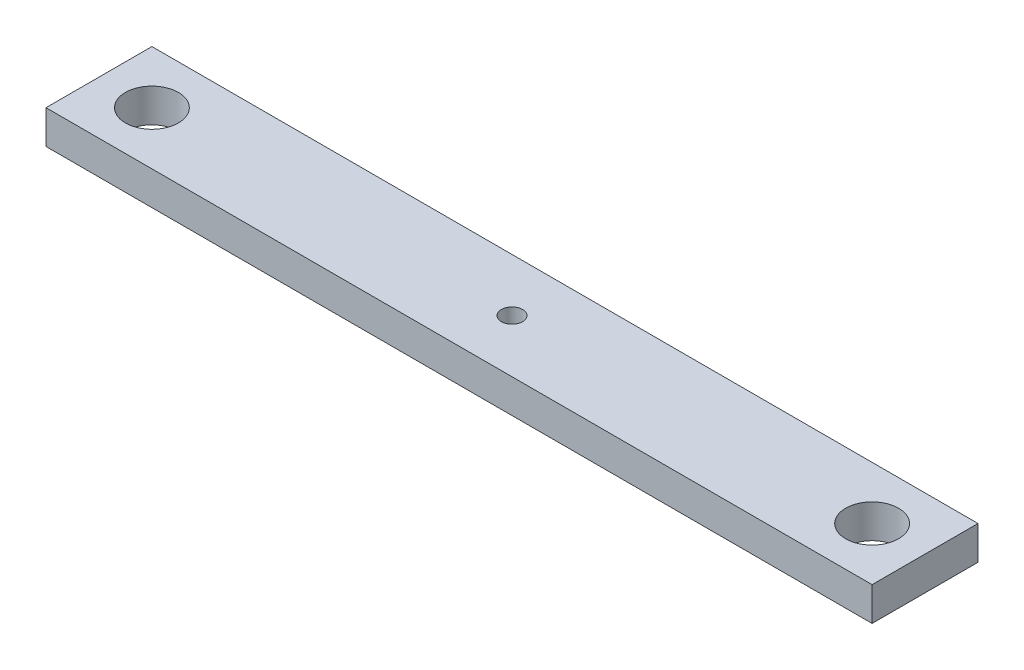
from build123d import *

# Parameters (mm, degrees)
SKETCH2_W           = 78
SKETCH2_H           = 10
BOSS_EXTRUDE1_DEPTH = 3.175
SKETCH3_R           = 2.5
CUT_EXTRUDE1_DEPTH  = 3.175
CUT_EXTRUDE2_REACH  = 41.447
SKETCH4_R           = 1


with BuildPart() as part:
    # Sketch2 → Boss-Extrude1 (new body)
    with BuildSketch(Plane(origin=(0, 0, 0), x_dir=(1, 0, 0), z_dir=(0, 1, 0))):
        Rectangle(SKETCH2_W, SKETCH2_H)
    extrude(amount=BOSS_EXTRUDE1_DEPTH)

    # Sketch3 → Cut-Extrude1 (cut)
    with BuildSketch(Plane(origin=(0, 3.175, 0), x_dir=(1, 0, 0), z_dir=(0, 1, 0))):
        with Locations(Location((-34, 0, 0), (0, 0, 270))):
            Circle(SKETCH3_R)
        with Locations(Location((34, 0, 0), (0, 0, 90))):
            Circle(SKETCH3_R)
    extrude(amount=-CUT_EXTRUDE1_DEPTH, mode=Mode.SUBTRACT)

    # Sketch4 → Cut-Extrude2 (cut, up to next)
    with BuildSketch(Plane(origin=(0, 3.175, 0), x_dir=(1, 0, 0), z_dir=(0, 1, 0)), mode=Mode.PRIVATE) as cut_extrude2_sk1:
        with Locations(Location((0, 0, 0), (0, 0, 270))):
            Circle(SKETCH4_R)
    cut_extrude2_tool1 = extrude(cut_extrude2_sk1.sketch, amount=-CUT_EXTRUDE2_REACH, mode=Mode.PRIVATE) & part.part
    add(cut_extrude2_tool1.solids().sort_by_distance((0, 3.175, 0))[0], mode=Mode.SUBTRACT)


solid = part.part
